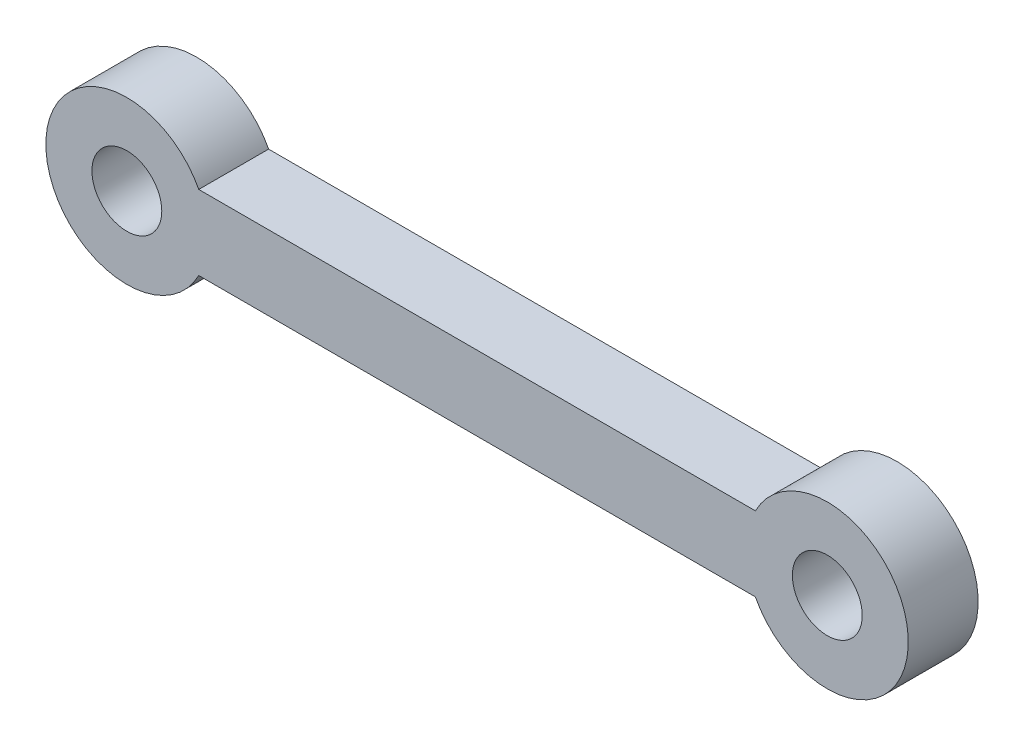
from build123d import *

# Parameters (mm, degrees)
SKETCH1_R           = 1.5
BOSS_EXTRUDE1_DEPTH = 3


with BuildPart() as part:
    # Sketch1 → Boss-Extrude1 (new body)
    with BuildSketch(Plane.XY):
        with BuildLine():
            Line((3.087382806, 1.6), (26.987382806, 1.6))
            ThreePointArc((26.987382806, 1.6), (33.552111236, 0), (26.987382806, -1.6))
            Line((26.987382806, -1.6), (3.087382806, -1.6))
            ThreePointArc((3.087382806, -1.6), (-3.477345624, 0), (3.087382806, 1.6))
        make_face()
        Circle(SKETCH1_R, mode=Mode.SUBTRACT)
        with Locations((30.074765612, 0)):
            Circle(SKETCH1_R, mode=Mode.SUBTRACT)
    extrude(amount=BOSS_EXTRUDE1_DEPTH)


solid = part.part
